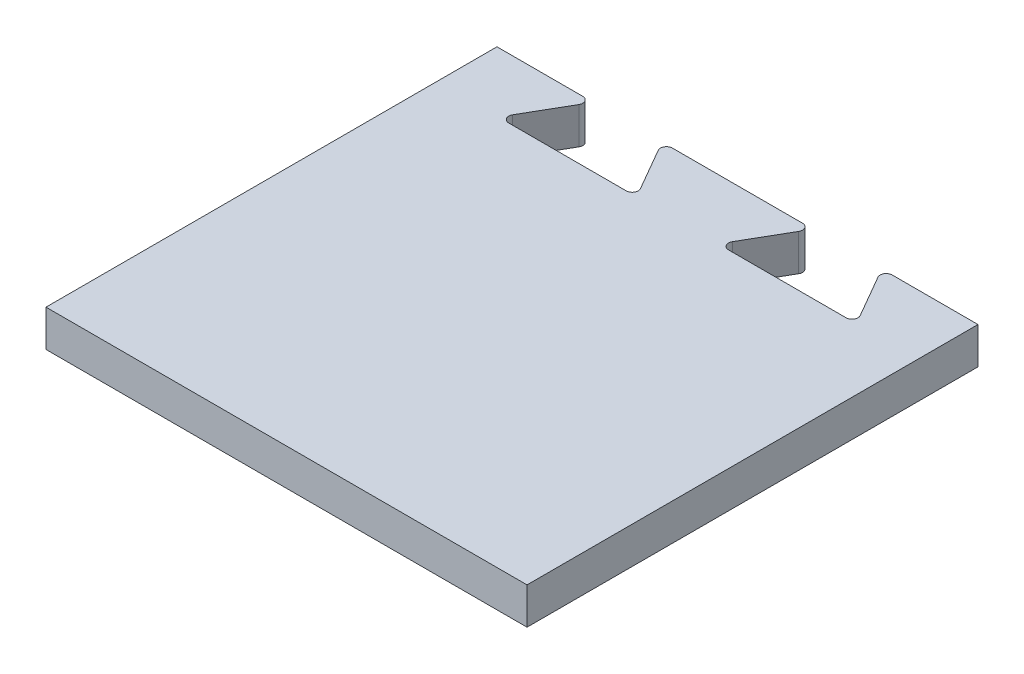
from build123d import *

# Parameters (mm, degrees)
BOSS_EXTRUDE1_DEPTH = 3.05
FILLET3_R           = 0.5


with BuildPart() as part:
    # Sketch1 → Boss-Extrude1 (new body)
    with BuildSketch(Plane(origin=(0, 0, 0), x_dir=(1, 0, 0), z_dir=(0, 1, 0))):
        Polygon((0, 0), (0, 37.5), (8, 37.5), (5.113248654, 32.5), (16.613248654, 32.5), (13.726497308, 37.5), (26.273502692, 37.5), (23.386751346, 32.5), (34.886751346, 32.5), (32, 37.5), (40, 37.5), (40, 0), align=None)
    extrude(amount=BOSS_EXTRUDE1_DEPTH)

    # Fillet3
    fillet3_edges = [part.edges().sort_by_distance(p)[0] for p in [
        (8, 1.525, -37.5),
        (5.113248654, 1.525, -32.5),
        (16.613248654, 1.525, -32.5),
        (13.726497308, 1.525, -37.5),
        (26.273502692, 1.525, -37.5),
        (23.386751346, 1.525, -32.5),
        (34.886751346, 1.525, -32.5),
        (32, 1.525, -37.5),
    ]]
    fillet(fillet3_edges, radius=FILLET3_R)


solid = part.part
